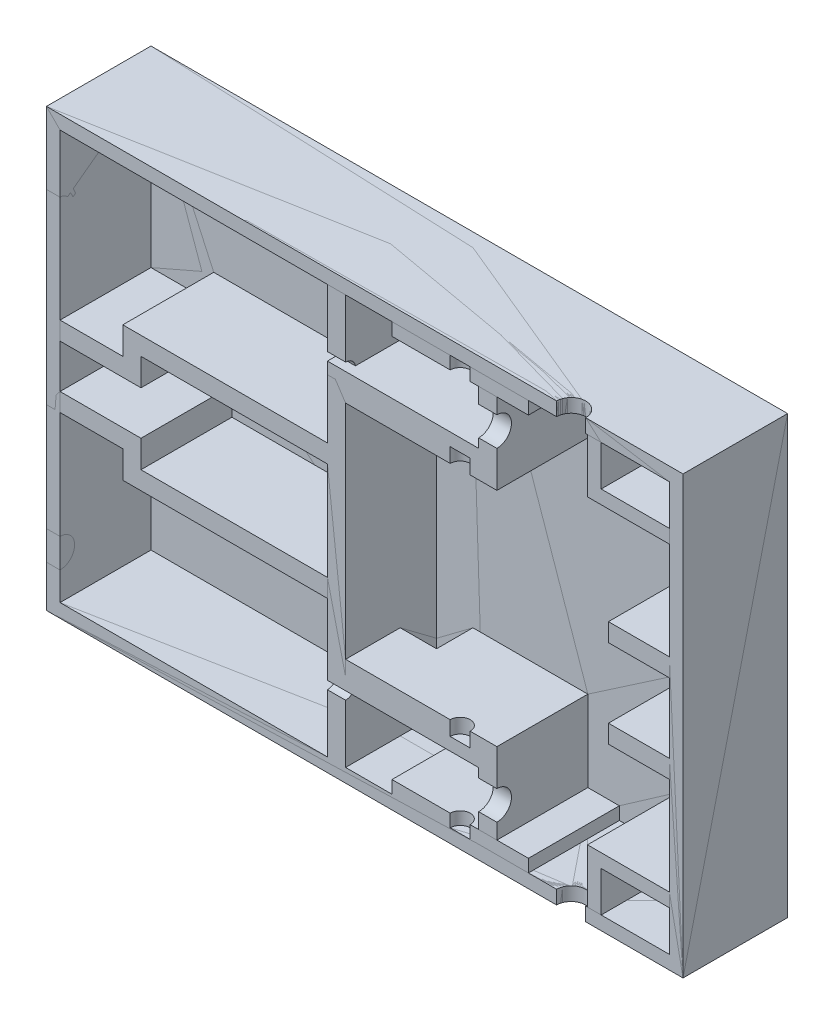
from build123d import *

# Parameters (mm, degrees)
SKETCH_1_W          = 70
SKETCH_1_H          = 48
EXTRUDE_1_DEPTH     = 11.5
SHELL_1_T           = -1.5
SKETCH_2_W          = 15
SKETCH_2_H          = 1.4
SKETCH_2_W_2        = 6.7
SKETCH_2_H_2        = 2
EXTRUDE_2_DEPTH     = 10
SKETCH_3_W          = 4
SKETCH_3_H          = 4
CUT_EXTRUDE_1_DEPTH = 20
SKETCH_4_R          = 1.6
CUT_EXTRUDE_2_DEPTH = 61.508263898
CUT_EXTRUDE_3_REACH = 76.888
SKETCH_5_R          = 1.6
SKETCH_5_R_2        = 1.1
CUT_EXTRUDE_START   = -1.5
SKETCH_6_R          = 1.1
CUT_EXTRUDE_4_DEPTH = 36.3
CUT_EXTRUDE_5_REACH = 76.888
SKETCH_8_W          = 7.5
SKETCH_8_H          = 3.1


with BuildPart() as part:
    # 草图1 → 凸台-拉伸1 (new body)
    with BuildSketch(Plane.XY):
        Rectangle(SKETCH_1_W, SKETCH_1_H)
    extrude(amount=EXTRUDE_1_DEPTH)

    # 抽壳1
    shell_1_openings = [part.faces().sort_by_distance(p)[0] for p in [
        (0, 0, 11.5),
    ]]
    offset(amount=SHELL_1_T, openings=shell_1_openings, kind=Kind.INTERSECTION)

    # 草图2 → 凸台-拉伸2 (add)
    with BuildSketch(Plane.XY.offset(1.5)):
        Polygon((-26.6, 7.4), (-4.1, 7.4), (-4.1, 22.5), (-2.1, 22.5), (-2.1, -12.2), (6.455957795, -12.2), (14.535957795, -12.2), (14.535957795, -22.5), (12.535957795, -22.5), (12.535957795, -15.2), (8.455957795, -15.2), (-4.1, -15.2), (-4.1, 5.4), (-24.6, 5.4), (-24.6, 2.4), (-33.5, 2.4), (-33.5, 4.4), (-26.6, 4.4), align=None)
        with Locations((10.5, 21.8)):
            Rectangle(SKETCH_2_W, SKETCH_2_H)
        Polygon((24.5, 22.5), (24.5, 16.56560625), (33.5, 16.56560625), (33.5, 18.06560625), (26, 18.06560625), (26, 22.5), align=None)
        with Locations((30.15, -4.83439375)):
            Rectangle(SKETCH_2_W_2, SKETCH_2_H_2)
    extrude(amount=EXTRUDE_2_DEPTH)

    # 草图3 → 切除-拉伸1 (cut)
    with BuildSketch(Plane.XZ.offset(24)):
        with Locations((-0.1, 3.5)):
            Rectangle(SKETCH_3_W, SKETCH_3_H)
    extrude(amount=-CUT_EXTRUDE_1_DEPTH, mode=Mode.SUBTRACT)

    # 草图4 → 切除-拉伸2 (cut, through all)
    with BuildSketch(Plane.XZ.offset(24)):
        with Locations((22.7, 11.5)):
            Circle(SKETCH_4_R)
    extrude(amount=-CUT_EXTRUDE_2_DEPTH, mode=Mode.SUBTRACT)

    # 切除-拉伸3: up to this face of the body (flat: up to its plane)
    cut_extrude_3_end = Plane(part.part.faces().sort_by_distance((14.535957795, -17.35, 6.5))[0])
    # 草图5 → 切除-拉伸3 (cut, up to the picked face)
    with BuildSketch(Plane.ZY.offset(35), mode=Mode.PRIVATE) as cut_extrude_3_sk1:
        with Locations((11.5, -17.8)):
            Circle(SKETCH_5_R)
    cut_extrude_3_tool1 = split(extrude(cut_extrude_3_sk1.sketch, amount=-CUT_EXTRUDE_3_REACH, mode=Mode.PRIVATE), bisect_by=cut_extrude_3_end, keep=Keep.BOTH, mode=Mode.PRIVATE)
    # 草图5 → 切除-拉伸3 (cut, up to the picked face)
    with BuildSketch(Plane.ZY.offset(35), mode=Mode.PRIVATE) as cut_extrude_3_sk2:
        with Locations((11.5, 15)):
            Circle(SKETCH_5_R_2)
    cut_extrude_3_tool2 = split(extrude(cut_extrude_3_sk2.sketch, amount=-CUT_EXTRUDE_3_REACH, mode=Mode.PRIVATE), bisect_by=cut_extrude_3_end, keep=Keep.BOTH, mode=Mode.PRIVATE)
    add(cut_extrude_3_tool1.solids().sort_by(Axis((-35, -17.8, 11.5), (1, 0, 0)))[0], mode=Mode.SUBTRACT)
    add(cut_extrude_3_tool2.solids().sort_by(Axis((-35, 15, 11.5), (1, 0, 0)))[0], mode=Mode.SUBTRACT)

    # 草图6 → 切除-拉伸4 (cut)
    with BuildSketch(Plane(origin=(0, 24, 0), x_dir=(1, 0, 0), z_dir=(0, 1, 0)).offset(CUT_EXTRUDE_START)):
        with Locations((10.5, -11.5)):
            Circle(SKETCH_6_R)
    extrude(amount=-CUT_EXTRUDE_4_DEPTH, mode=Mode.SUBTRACT)

    # 草图8 → 切除-拉伸5 (cut, up to next)
    with BuildSketch(Plane.ZY.offset(35), mode=Mode.PRIVATE) as cut_extrude_5_sk1:
        with Locations((7.75, 5.95)):
            Rectangle(SKETCH_8_W, SKETCH_8_H)
    cut_extrude_5_tool1 = extrude(cut_extrude_5_sk1.sketch, amount=-CUT_EXTRUDE_5_REACH, mode=Mode.PRIVATE) & part.part
    add(cut_extrude_5_tool1.solids().sort_by_distance((-35, 5.95, 7.75))[0], mode=Mode.SUBTRACT)


with BuildPart() as body_2:
    # 镜向1: mirrored copy
    add(part.part.mirror(Plane.ZX))


solid = Compound([part.part, body_2.part])
